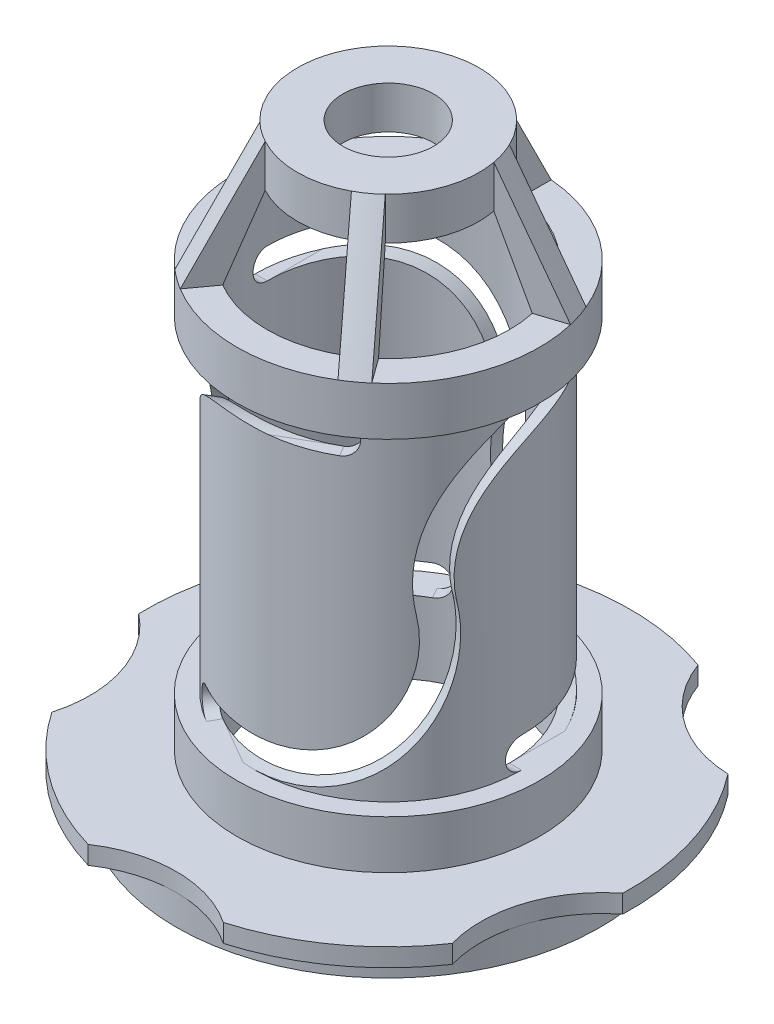
from build123d import *

# Parameters (mm, degrees)
CUT_EXTRUDE_3_DEPTH      = 107.301458127
CUT_EXTRUDE_5_DEPTH      = 20
CUT_EXTRUDE_6_DEPTH      = 4
CUT_EXTRUDE_6_DRAFT      = -30
CUT_EXTRUDE_7_REACH      = 76.84
CUT_EXTRUDE_8_REACH      = 76.84
SKETCH_15_R              = 2.5
CUT_EXTRUDE_9_REACH      = 76.84
SKETCH_15_5_R            = 2.5
PATTERN_CIRCULAR_2_COUNT = 3


with BuildPart() as part:
    # 草图1 → 旋转1 (revolve)
    with BuildSketch(Plane.XY):
        Polygon((35, -49), (35, -44), (40, -44), (40, -41), (25, -41), (25, -33), (22, -33), (22, 21), (25, 21), (25, 29), (15, 49), (7.5, 49), (7.5, 42), (15, 42), (20, 29), (20, -49), align=None)
    revolve(axis=Axis((0, 74.454291325, 0), (0, -1, 0)))

    # 草图6 → 切除-拉伸3 (cut, through all)
    with BuildSketch(Plane(origin=(0, -41, 0), x_dir=(1, 0, 0), z_dir=(0, 1, 0))):
        with BuildLine():
            ThreePointArc((-11.168783978, -38.409090909), (0, -35), (11.168783978, -38.409090909))
            ThreePointArc((11.168783978, -38.409090909), (0, -40), (-11.168783978, -38.409090909))
        make_face()
        with BuildLine():
            ThreePointArc((-39.98056025, -1.246917048), (-38.042260652, -12.360679775), (-33.077872138, -22.49120661))
            ThreePointArc((-33.077872138, -22.49120661), (-33.28697807, -10.815594803), (-39.98056025, -1.246917048))
        make_face()
        with BuildLine():
            ThreePointArc((-13.540561146, 37.638453792), (-23.511410092, 32.360679775), (-31.612033235, 24.508760776))
            ThreePointArc((-31.612033235, 24.508760776), (-20.57248383, 28.315594803), (-13.540561146, 37.638453792))
        make_face()
        with BuildLine():
            ThreePointArc((31.612033235, 24.508760776), (23.511410092, 32.360679775), (13.540561146, 37.638453792))
            ThreePointArc((13.540561146, 37.638453792), (20.57248383, 28.315594803), (31.612033235, 24.508760776))
        make_face()
        with BuildLine():
            ThreePointArc((33.077872138, -22.49120661), (38.042260652, -12.360679775), (39.98056025, -1.246917048))
            ThreePointArc((39.98056025, -1.246917048), (33.28697807, -10.815594803), (33.077872138, -22.49120661))
        make_face()
    extrude(amount=-CUT_EXTRUDE_3_DEPTH, mode=Mode.SUBTRACT)

    # 草图12 → 切除-拉伸5 (cut)
    with BuildSketch(Plane(origin=(0, 49, 0), x_dir=(1, 0, 0), z_dir=(0, 1, 0))):
        with BuildLine():
            Line((-2, 24.919871589), (-2, 14.866068747))
            ThreePointArc((-2, 14.866068747), (-8.816778784, 12.135254916), (-13.520437565, 6.495980915))
            Line((-13.520437565, 6.495980915), (-23.082172271, 9.602776851))
            ThreePointArc((-23.082172271, 9.602776851), (-14.694631307, 20.225424859), (-2, 24.919871589))
        make_face()
        with BuildLine():
            Line((2, 24.919871589), (2, 14.866068747))
            ThreePointArc((2, 14.866068747), (8.816778784, 12.135254916), (13.520437565, 6.495980915))
            Line((13.520437565, 6.495980915), (23.082172271, 9.602776851))
            ThreePointArc((23.082172271, 9.602776851), (14.694631307, 20.225424859), (2, 24.919871589))
        make_face()
        with BuildLine():
            Line((24.318240248, 5.798550786), (14.756505543, 2.69175485))
            ThreePointArc((14.756505543, 2.69175485), (14.265847744, -4.635254916), (10.356089958, -10.851331752))
            Line((10.356089958, -10.851331752), (16.265566998, -18.985029108))
            ThreePointArc((16.265566998, -18.985029108), (23.776412907, -7.725424859), (24.318240248, 5.798550786))
        make_face()
        with BuildLine():
            Line((13.02949902, -21.336170118), (7.12002198, -13.202472761))
            ThreePointArc((7.12002198, -13.202472761), (0, -15), (-7.12002198, -13.202472761))
            Line((-7.12002198, -13.202472761), (-13.02949902, -21.336170118))
            ThreePointArc((-13.02949902, -21.336170118), (0, -25), (13.02949902, -21.336170118))
        make_face()
        with BuildLine():
            Line((-16.265566998, -18.985029108), (-10.356089958, -10.851331752))
            ThreePointArc((-10.356089958, -10.851331752), (-14.265847744, -4.635254916), (-14.756505543, 2.69175485))
            Line((-14.756505543, 2.69175485), (-24.318240248, 5.798550786))
            ThreePointArc((-24.318240248, 5.798550786), (-23.776412907, -7.725424859), (-16.265566998, -18.985029108))
        make_face()
    extrude(amount=-CUT_EXTRUDE_5_DEPTH, mode=Mode.SUBTRACT)


with BuildPart() as cut_extrude_6_tool:
    # 草图13 → 切除-拉伸6 (with draft: the straight prism first)
    with BuildSketch(Plane.XZ.offset(49)):
        Polygon((31.740403624, -10.313082304), (19.616648256, 27), (-19.616648256, 27), (-31.740403624, -10.313082304), (0, -33.373835392), align=None)
    extrude(amount=-CUT_EXTRUDE_6_DEPTH)
    # 切除-拉伸6: the draft: its side faces are tilted about the plane it starts from
    cut_extrude_6_sides = [cut_extrude_6_tool.faces().sort_by_distance(p)[0] for p in [
        (25.67852594, -47, 8.343458848),
        (0, -47, 27),
        (-25.67852594, -47, 8.343458848),
        (-15.870201812, -47, -21.843458848),
        (15.870201812, -47, -21.843458848),
    ]]
    draft(cut_extrude_6_sides, Plane.XZ.offset(49), CUT_EXTRUDE_6_DRAFT)


with BuildPart() as part_1:
    add(part.part)

    # 切除-拉伸6: cut by cut_extrude_6_tool
    add(cut_extrude_6_tool.part, mode=Mode.SUBTRACT)

    # 草图14 → 切除-拉伸7 (cut, up to next)
    with BuildSketch(Plane.XY, mode=Mode.PRIVATE) as cut_extrude_7_sk1:
        with BuildLine():
            Line((20, -28), (22, -28))
            Line((22, -28), (22, -33))
            Line((22, -33), (20, -33))
            ThreePointArc((20, -33), (2.249982399, -24.576544981), (-2.449387653, -5.499500125))
            ThreePointArc((-2.449387653, -5.499500125), (-6.123288399, 9.414662531), (-20, 16))
            Line((-20, 16), (-22, 16))
            Line((-22, 16), (-22, 21))
            Line((-22, 21), (-20, 21))
            ThreePointArc((-20, 21), (-2.249982399, 12.576544981), (2.449387653, -6.500499875))
            ThreePointArc((2.449387653, -6.500499875), (6.123288399, -21.414662531), (20, -28))
        make_face()
    cut_extrude_7_tool1 = extrude(cut_extrude_7_sk1.sketch, amount=-CUT_EXTRUDE_7_REACH, mode=Mode.PRIVATE) & part_1.part
    cut_extrude_7 = cut_extrude_7_tool1.solids().sort_by_distance((0, -6, 0))[0]
    add(cut_extrude_7, mode=Mode.SUBTRACT)

    # 草图15 → 切除-拉伸8 (cut, up to next)
    with BuildSketch(Plane(origin=(0, 0, 0), x_dir=(0, 0, -1), z_dir=(1, 0, 0)), mode=Mode.PRIVATE) as cut_extrude_8_sk1:
        with Locations((0, 18.5)):
            Circle(SKETCH_15_R)
    cut_extrude_8_tool1 = extrude(cut_extrude_8_sk1.sketch, amount=-CUT_EXTRUDE_8_REACH, mode=Mode.PRIVATE) & part_1.part
    cut_extrude_8 = cut_extrude_8_tool1.solids().sort_by_distance((0, 18.5, 0))[0]
    add(cut_extrude_8, mode=Mode.SUBTRACT)

    # 草图15<5> → 切除-拉伸9 (cut, up to next)
    with BuildSketch(Plane(origin=(0, 0, 0), x_dir=(0, 0, -1), z_dir=(1, 0, 0)), mode=Mode.PRIVATE) as cut_extrude_9_sk1:
        with Locations((0, -30.5)):
            Circle(SKETCH_15_5_R)
    cut_extrude_9_tool1 = extrude(cut_extrude_9_sk1.sketch, amount=CUT_EXTRUDE_9_REACH, mode=Mode.PRIVATE) & part_1.part
    cut_extrude_9 = cut_extrude_9_tool1.solids().sort_by_distance((0, -30.5, 0))[0]
    add(cut_extrude_9, mode=Mode.SUBTRACT)

    # 阵列(圆周)2: 切除-拉伸7, 切除-拉伸8, 切除-拉伸9 ×3 about axis
    pattern_circular_2_axis = Axis((0, 0, 0), (0, 1, 0))
    add([cut_extrude_7.rotate(pattern_circular_2_axis, i * 360 / PATTERN_CIRCULAR_2_COUNT) for i in range(1, PATTERN_CIRCULAR_2_COUNT)], mode=Mode.SUBTRACT)
    add([cut_extrude_8.rotate(pattern_circular_2_axis, i * 360 / PATTERN_CIRCULAR_2_COUNT) for i in range(1, PATTERN_CIRCULAR_2_COUNT)], mode=Mode.SUBTRACT)
    add([cut_extrude_9.rotate(pattern_circular_2_axis, i * 360 / PATTERN_CIRCULAR_2_COUNT) for i in range(1, PATTERN_CIRCULAR_2_COUNT)], mode=Mode.SUBTRACT)


solid = part_1.part
